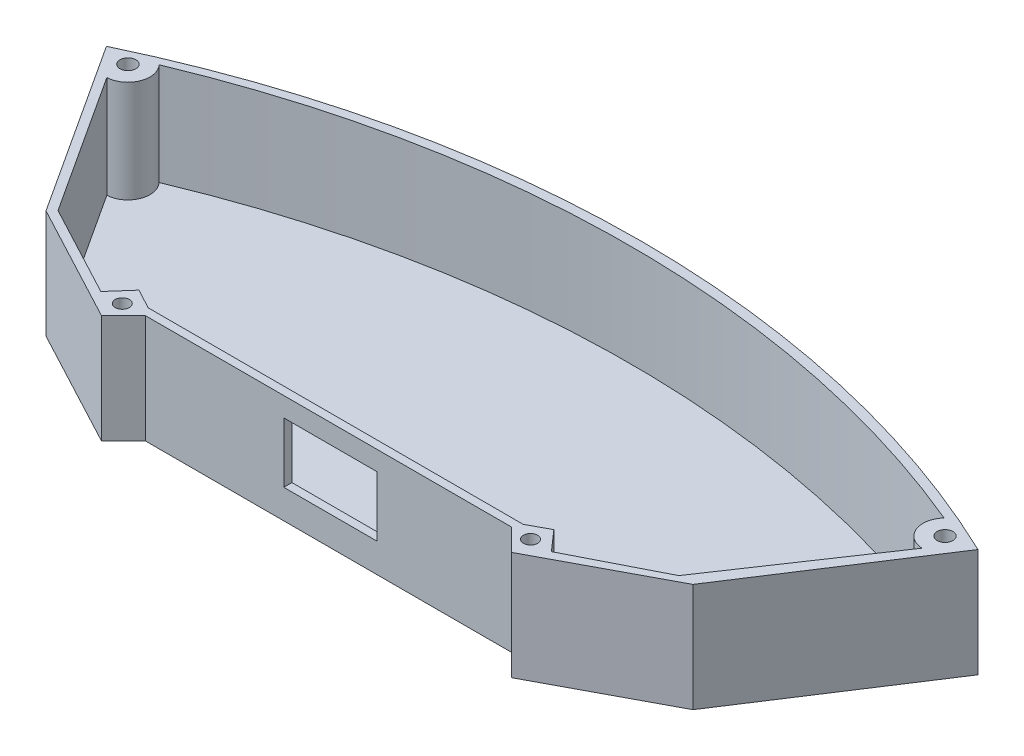
from build123d import *

# Parameters (mm, degrees)
SKETCH1_W           = 95.3
SKETCH1_H           = 79
BOSS_EXTRUDE1_DEPTH = 33
SKETCH5_W           = 16.412638375
SKETCH5_H           = 11.424483575
CUT_EXTRUDE3_DEPTH  = 51
SKETCH4_W           = 19.8
SKETCH4_H           = 11.7
CUT_EXTRUDE4_DEPTH  = 51
BOSS_EXTRUDE2_START = 30
BOSS_EXTRUDE2_DEPTH = 3
CUT_EXTRUDE6_START  = 2
SKETCH3_W           = 91.3
SKETCH3_H           = 75
CUT_EXTRUDE6_DEPTH  = 33
BOSS_EXTRUDE3_DEPTH = 33
CUT_EXTRUDE7_START  = 2
CUT_EXTRUDE7_DEPTH  = 33
SKETCH13_W          = 28.277376506
SKETCH13_H          = 18.284619395
CUT_EXTRUDE8_DEPTH  = 63
CUT_EXTRUDE9_START  = 15
SKETCH15_R          = 2.404549827
SKETCH15_R_2        = 2.15
CUT_EXTRUDE9_DEPTH  = 63


with BuildPart() as part:
    # Sketch1 → Boss-Extrude1 (new body)
    with BuildSketch(Plane(origin=(0, 0, 0), x_dir=(1, 0, 0), z_dir=(0, 1, 0))):
        with Locations((1.627011494, 0.770114943)):
            Rectangle(SKETCH1_W, SKETCH1_H)
    extrude(amount=BOSS_EXTRUDE1_DEPTH)

    # Sketch5 → Cut-Extrude3 (cut)
    with BuildSketch(Plane(origin=(0, 0, 0), x_dir=(0, 0, -1), z_dir=(1, 0, 0))):
        with Locations((21.044550583, 16.58045411)):
            Rectangle(SKETCH5_W, SKETCH5_H)
    extrude(amount=CUT_EXTRUDE3_DEPTH, mode=Mode.SUBTRACT)

    # Sketch4 → Cut-Extrude4 (cut)
    with BuildSketch(Plane.XY):
        with Locations((-28.653400332, 16.73218903)):
            Rectangle(SKETCH4_W, SKETCH4_H)
    extrude(amount=CUT_EXTRUDE4_DEPTH, mode=Mode.SUBTRACT)

    # Sketch6 → Boss-Extrude2 (add)
    with BuildSketch(Plane(origin=(0, 0, 0), x_dir=(1, 0, 0), z_dir=(0, 1, 0)).offset(BOSS_EXTRUDE2_START)):
        with BuildLine():
            Line((-54.022988506, -46.729885057), (57.277011494, -46.729885057))
            Line((57.277011494, -46.729885057), (57.277011494, 43.194295461))
            ThreePointArc((57.277011494, 43.194295461), (1.627011494, 48.270114943), (-54.022988506, 43.194295461))
            Line((-54.022988506, 43.194295461), (-54.022988506, -46.729885057))
        make_face()
    extrude(amount=BOSS_EXTRUDE2_DEPTH)

    # Sketch3 → Cut-Extrude6 (cut)
    with BuildSketch(Plane(origin=(0, 0, 0), x_dir=(1, 0, 0), z_dir=(0, 1, 0)).offset(CUT_EXTRUDE6_START)):
        with Locations((1.627011494, 0.770114943)):
            Rectangle(SKETCH3_W, SKETCH3_H)
    extrude(amount=CUT_EXTRUDE6_DEPTH, mode=Mode.SUBTRACT)

    # Sketch7 → Boss-Extrude3 (add)
    with BuildSketch(Plane(origin=(0, 0, 0), x_dir=(1, 0, 0), z_dir=(0, 1, 0))):
        with BuildLine():
            Line((-54.022988506, -46.729885057), (-60.700936328, -53.40783288))
            Line((-60.700936328, -53.40783288), (-96.723977713, -34.253129761))
            Line((-96.723977713, -34.253129761), (-130.872988506, 18.270114943))
            ThreePointArc((-130.872988506, 18.270114943), (1.627011494, 48.270114943), (134.127011494, 18.270114943))
            Line((134.127011494, 18.270114943), (99.978000701, -34.253129761))
            Line((99.978000701, -34.253129761), (63.954959317, -53.40783288))
            Line((63.954959317, -53.40783288), (57.277011494, -46.729885057))
            Line((57.277011494, -46.729885057), (-54.022988506, -46.729885057))
        make_face()
    extrude(amount=BOSS_EXTRUDE3_DEPTH)

    # Sketch12 → Cut-Extrude7 (cut)
    with BuildSketch(Plane(origin=(0, 0, 0), x_dir=(1, 0, 0), z_dir=(0, 1, 0)).offset(CUT_EXTRUDE7_START)):
        with BuildLine():
            Line((-55.675241183, -44.247946624), (-61.717664186, -40.981103814))
            Line((-61.717664186, -40.981103814), (-67.147920345, -47.148292557))
            Line((-67.147920345, -47.148292557), (-94.980050769, -32.348981479))
            Line((-94.980050769, -32.348981479), (-122.582923998, 10.105907593))
            ThreePointArc((-122.582923998, 10.105907593), (-116.666047132, 14.289696558), (-118.009133951, 21.410766685))
            ThreePointArc((-118.009133951, 21.410766685), (1.346034443, 45.347959229), (120.701202837, 21.410766685))
            ThreePointArc((120.701202837, 21.410766685), (119.358116018, 14.289696558), (125.274992883, 10.105907593))
            Line((125.274992883, 10.105907593), (95.518671487, -34.090338294))
            Line((95.518671487, -34.090338294), (69.839989231, -47.148292557))
            Line((69.839989231, -47.148292557), (64.409733071, -40.981103814))
            Line((64.409733071, -40.981103814), (58.367310069, -44.247946624))
            Line((58.367310069, -44.247946624), (-55.675241183, -44.247946624))
        make_face()
    extrude(amount=CUT_EXTRUDE7_DEPTH, mode=Mode.SUBTRACT)

    # Sketch13 → Cut-Extrude8 (cut)
    with BuildSketch(Plane.XY):
        with Locations((2.186144679, 17.976259721)):
            Rectangle(SKETCH13_W, SKETCH13_H)
    extrude(amount=CUT_EXTRUDE8_DEPTH, mode=Mode.SUBTRACT)

    # Sketch15 → Cut-Extrude9 (cut)
    with BuildSketch(Plane(origin=(0, 0, 0), x_dir=(1, 0, 0), z_dir=(0, 1, 0)).offset(CUT_EXTRUDE9_START)):
        with Locations(Location((-122.881880972, 16.804537187, 0), (0, 0, 270))):
            Circle(SKETCH15_R)
        with Locations(Location((-60.728139954, -47.058565961, 0), (0, 0, 270))):
            Circle(SKETCH15_R_2)
        with Locations(Location((63.420208839, -47.058565961, 0), (0, 0, 90))):
            Circle(SKETCH15_R_2)
        with Locations(Location((125.573949857, 16.804537187, 0), (0, 0, 90))):
            Circle(SKETCH15_R)
    extrude(amount=CUT_EXTRUDE9_DEPTH, mode=Mode.SUBTRACT)


solid = part.part
